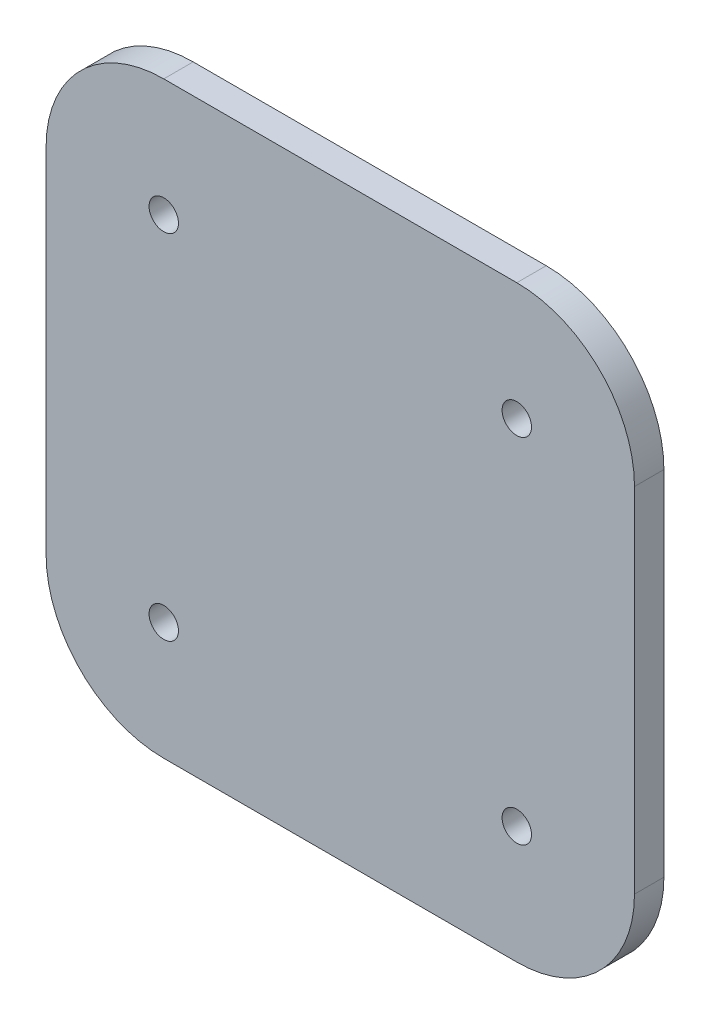
from build123d import *

# Parameters (mm, degrees)
ESQUISSE1_W             = 100
ESQUISSE1_H             = 100
BOSS_EXTRU_1_DEPTH      = 5
ESQUISSE2_R             = 2.5
ENL_V_MAT_EXTRU_1_DEPTH = 5
CONG_1_R                = 20


with BuildPart() as part:
    # Esquisse1 → Boss.-Extru.1 (new body)
    with BuildSketch(Plane.XY):
        with Locations((-20.361115905, -10.363536379)):
            Rectangle(ESQUISSE1_W, ESQUISSE1_H)
    extrude(amount=BOSS_EXTRU_1_DEPTH)

    # Esquisse2 → Enlèv. mat.-Extru.1 (cut)
    with BuildSketch(Plane.XY.offset(5)):
        with Locations((-50.361115905, 19.636463621)):
            Circle(ESQUISSE2_R)
        with Locations((-50.361115905, -40.363536379)):
            Circle(ESQUISSE2_R)
        with Locations((9.638884095, -40.363536379)):
            Circle(ESQUISSE2_R)
        with Locations((9.638884095, 19.636463621)):
            Circle(ESQUISSE2_R)
    extrude(amount=-ENL_V_MAT_EXTRU_1_DEPTH, mode=Mode.SUBTRACT)

    # Congé1
    cong_1_edges = [part.edges().sort_by_distance(p)[0] for p in [
        (-70.361115905, 39.636463621, 2.5),
        (29.638884095, 39.636463621, 2.5),
        (29.638884095, -60.363536379, 2.5),
        (-70.361115905, -60.363536379, 2.5),
    ]]
    fillet(cong_1_edges, radius=CONG_1_R)


solid = part.part
